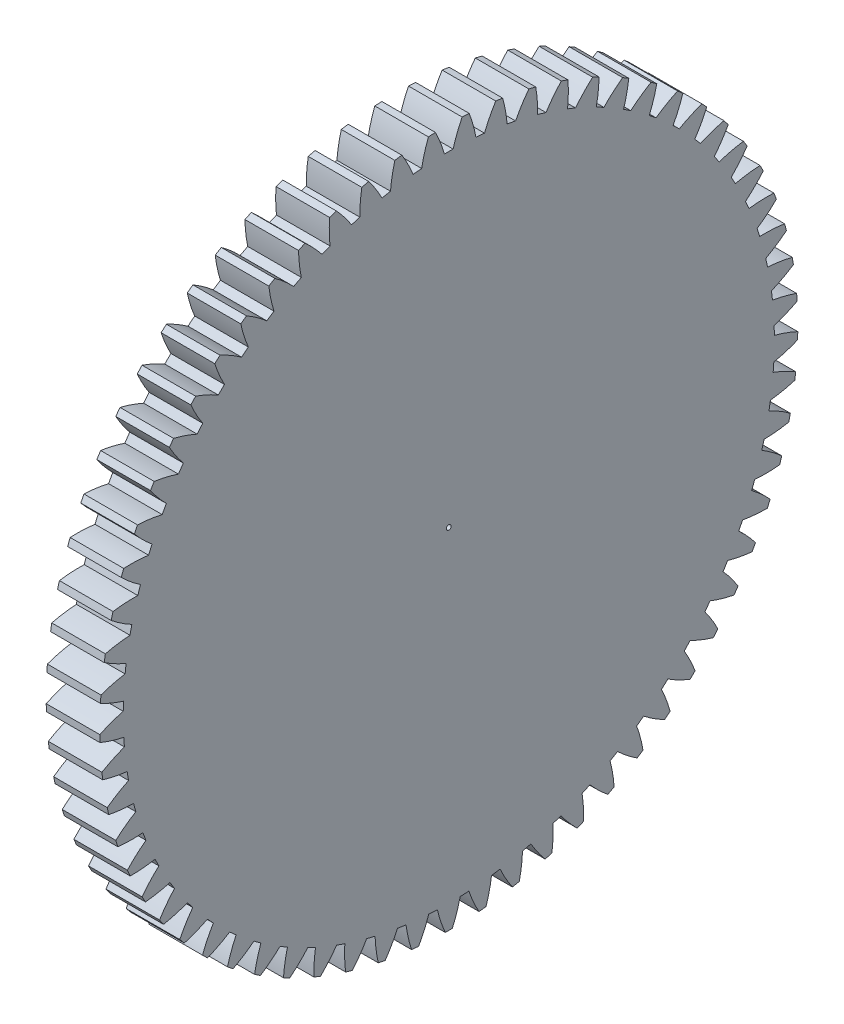
from build123d import *

# Parameters (mm, degrees)
BASPROSKE_W     = 9
BASPROSKE_H     = 58.625
TOOTHCUT_DEPTH  = 84.395331104
TEETHCUTS_COUNT = 65
TEETHCUTS_ANGLE = 354.461538462
BORSKE_R        = 0.4
BORE_DEPTH      = 50.0000508


with BuildPart() as part:
    # BasProSke → Base-Revolve (revolve)
    with BuildSketch(Plane(origin=(0, 0, 0), x_dir=(1, 0, 0), z_dir=(0, 1, 0)), mode=Mode.PRIVATE) as base_revolve_sk:
        with Locations((4.5, 29.3125)):
            Rectangle(BASPROSKE_W, BASPROSKE_H)
    revolve(base_revolve_sk.sketch.rotate(Axis((-10, 0, 0), (1, 0, 0)), 180), axis=Axis((-10, 0, 0), (1, 0, 0)))

    # TooCutSke → ToothCut (cut, through all)
    with BuildSketch(Plane(origin=(0, 0, 0), x_dir=(0, 0, -1), z_dir=(1, 0, 0))):
        with BuildLine():
            ThreePointArc((0.725136903, 54.681692171), (0, 54.6865), (-0.725136903, 54.681692171))
            ThreePointArc((-0.725136903, 54.681692171), (-1.397650079, 56.679833845), (-2.252247657, 58.607139502))
            ThreePointArc((-2.252247657, 58.607139502), (0, 58.6504), (2.252247657, 58.607139502))
            ThreePointArc((2.252247657, 58.607139502), (1.397650079, 56.679833845), (0.725136903, 54.681692171))
        make_face()
    toothcut = extrude(amount=TOOTHCUT_DEPTH, mode=Mode.SUBTRACT)

    # TeethCuts: ToothCut ×65 about axis
    teethcuts_axis = Axis((-10, 0, 0), (1, 0, 0))
    for i in range(1, TEETHCUTS_COUNT):
        add(toothcut.rotate(teethcuts_axis, i * TEETHCUTS_ANGLE / (TEETHCUTS_COUNT - 1)), mode=Mode.SUBTRACT)

    # BorSke → Bore (cut, symmetric)
    with BuildSketch(Plane(origin=(0, 0, 0), x_dir=(0, 0, -1), z_dir=(1, 0, 0))):
        with Locations(Location((0, 0, 0), (0, 0, 180))):
            Circle(BORSKE_R)
    extrude(amount=BORE_DEPTH, both=True, mode=Mode.SUBTRACT)


solid = part.part
